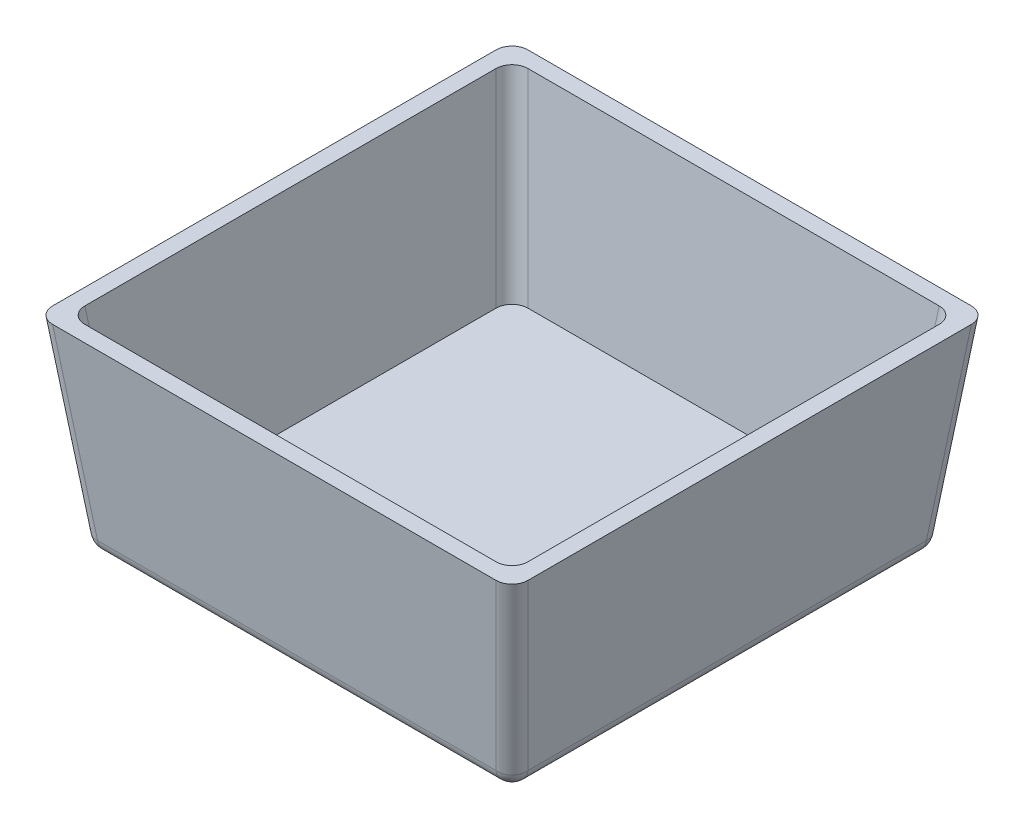
from build123d import *

# Parameters (mm, degrees)
SKETCH4_W           = 53
SKETCH4_H           = 53
BOSS_EXTRUDE3_DEPTH = 2
FILLET1_R           = 2


with BuildPart() as part:
    # Sketch1 → Loft2 section 0
    with BuildSketch(Plane(origin=(0, 0, 0), x_dir=(1, 0, 0), z_dir=(0, 1, 0))):
        with BuildLine():
            Line((-26.5, -26.5), (26.5, -26.5))
            Line((26.5, -26.5), (26.5, 26.5))
            Line((26.5, 26.5), (-26.5, 26.5))
            Line((-26.5, 26.5), (-26.5, -26.5))
        make_face()
    # Sketch3 → Loft2 section 1
    with BuildSketch(Plane(origin=(0, 25, 0), x_dir=(1, 0, 0), z_dir=(0, 1, 0))):
        with BuildLine():
            Line((-29.5, 29.5), (29.5, 29.5))
            Line((29.5, 29.5), (29.5, -29.5))
            Line((29.5, -29.5), (-29.5, -29.5))
            Line((-29.5, -29.5), (-29.5, 29.5))
        make_face()
    loft()

    # Sketch1<198> → Cut-Loft1 section 0
    with BuildSketch(Plane(origin=(0, 0, 0), x_dir=(1, 0, 0), z_dir=(0, 1, 0))):
        with BuildLine():
            Line((-24.5, 24.5), (24.5, 24.5))
            Line((24.5, 24.5), (24.5, -24.5))
            Line((24.5, -24.5), (-24.5, -24.5))
            Line((-24.5, -24.5), (-24.5, 24.5))
        make_face()
    # Sketch3<140> → Cut-Loft1 section 1
    with BuildSketch(Plane(origin=(0, 25, 0), x_dir=(1, 0, 0), z_dir=(0, 1, 0))):
        with BuildLine():
            Line((-27.5, -27.5), (27.5, -27.5))
            Line((27.5, -27.5), (27.5, 27.5))
            Line((27.5, 27.5), (-27.5, 27.5))
            Line((-27.5, 27.5), (-27.5, -27.5))
        make_face()
    loft(mode=Mode.SUBTRACT)

    # Sketch4 → Boss-Extrude3 (add)
    with BuildSketch(Plane.XZ):
        Rectangle(SKETCH4_W, SKETCH4_H)
    extrude(amount=-BOSS_EXTRUDE3_DEPTH)

    # Fillet1
    fillet1_edges = [part.edges().sort_by_distance(p)[0] for p in [
        (-26.12, 13.5, 26.12),
        (-26.12, 13.5, -26.12),
        (26.12, 13.5, 26.12),
        (26.12, 13.5, -26.12),
        (28, 12.5, 28),
        (-28, 12.5, 28),
        (-28, 12.5, -28),
        (28, 12.5, -28),
        (0, 0, 26.5),
        (-26.5, 0, 0),
        (26.5, 0, 0),
        (0, 0, -26.5),
    ]]
    fillet(fillet1_edges, radius=FILLET1_R)


solid = part.part
